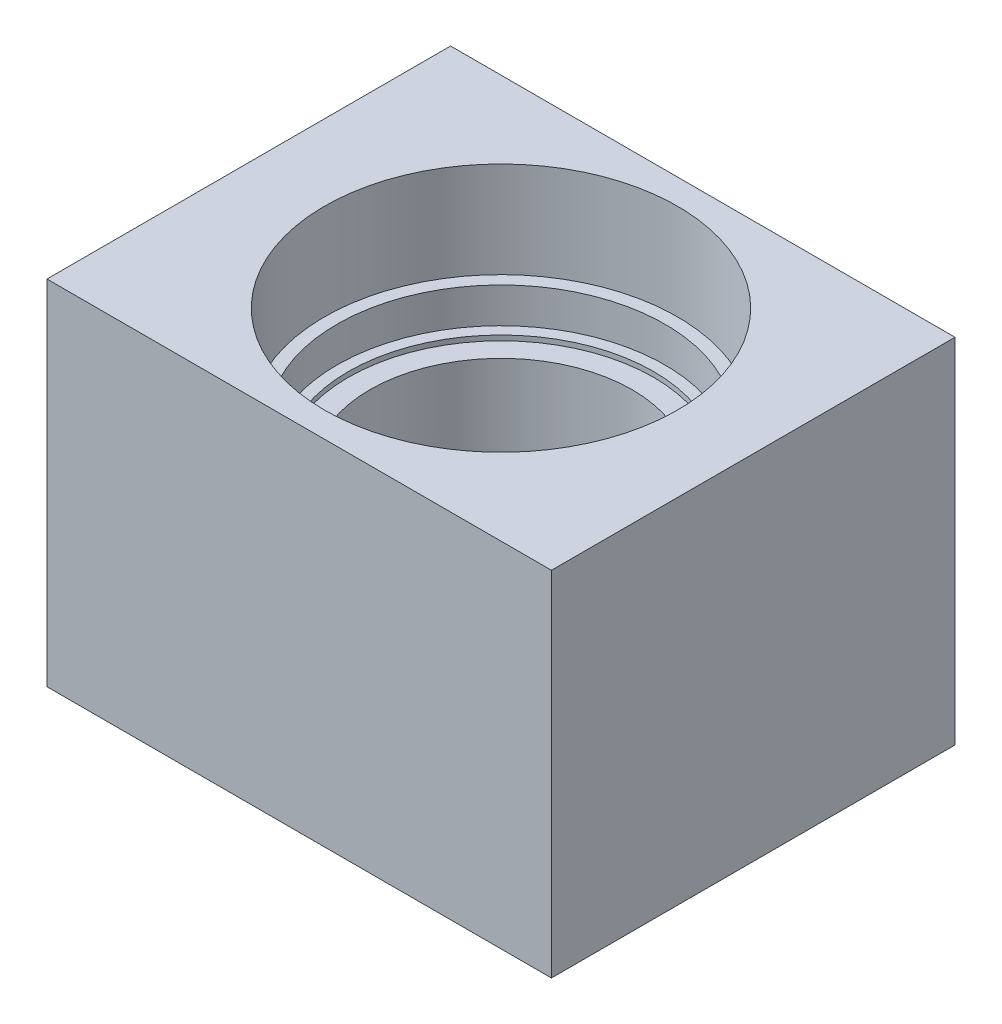
from build123d import *

# Parameters (mm, degrees)
SKETCH1_W           = 100
SKETCH1_H           = 80
SKETCH1_R           = 26
BOSS_EXTRUDE1_DEPTH = 70
SKETCH2_R           = 32.5
CUT_EXTRUDE1_DEPTH  = 27
BOSS_EXTRUDE2_START = 1
SKETCH4_R           = 32.5
SKETCH4_R_2         = 30.25
BOSS_EXTRUDE2_DEPTH = 1
SKETCH5_R           = 35
CUT_EXTRUDE2_DEPTH  = 19
CUT_EXTRUDE3_START  = -7
SKETCH6_R           = 32.5
CUT_EXTRUDE3_DEPTH  = 7


with BuildPart() as part:
    # Sketch1 → Boss-Extrude1 (new body)
    with BuildSketch(Plane(origin=(0, 0, 0), x_dir=(1, 0, 0), z_dir=(0, 1, 0))):
        Rectangle(SKETCH1_W, SKETCH1_H)
        with Locations(Location((0, 0, 0), (0, 0, 270))):
            Circle(SKETCH1_R, mode=Mode.SUBTRACT)
    extrude(amount=BOSS_EXTRUDE1_DEPTH)

    # Sketch2 → Cut-Extrude1 (cut)
    with BuildSketch(Plane(origin=(0, 70, 0), x_dir=(1, 0, 0), z_dir=(0, 1, 0))):
        with Locations(Location((0, 0, 0), (0, 0, 270))):
            Circle(SKETCH2_R)
    extrude(amount=-CUT_EXTRUDE1_DEPTH, mode=Mode.SUBTRACT)

    # Sketch4 → Boss-Extrude2 (add)
    with BuildSketch(Plane(origin=(0, 43, 0), x_dir=(1, 0, 0), z_dir=(0, 1, 0)).offset(BOSS_EXTRUDE2_START)):
        with Locations(Location((0, 0, 0), (0, 0, 270))):
            Circle(SKETCH4_R)
        with Locations(Location((0, 0, 0), (0, 0, 270))):
            Circle(SKETCH4_R_2, mode=Mode.SUBTRACT)
    extrude(amount=-BOSS_EXTRUDE2_DEPTH)

    # Sketch5 → Cut-Extrude2 (cut)
    with BuildSketch(Plane(origin=(0, 70, 0), x_dir=(1, 0, 0), z_dir=(0, 1, 0))):
        with Locations(Location((0, 0, 0), (0, 0, 270))):
            Circle(SKETCH5_R)
    extrude(amount=-CUT_EXTRUDE2_DEPTH, mode=Mode.SUBTRACT)

    # Sketch6 → Cut-Extrude3 (cut)
    with BuildSketch(Plane.XZ.offset(CUT_EXTRUDE3_START)):
        with Locations(Location((0, 0, 0), (0, 0, 90))):
            Circle(SKETCH6_R)
    extrude(amount=CUT_EXTRUDE3_DEPTH, mode=Mode.SUBTRACT)


solid = part.part
